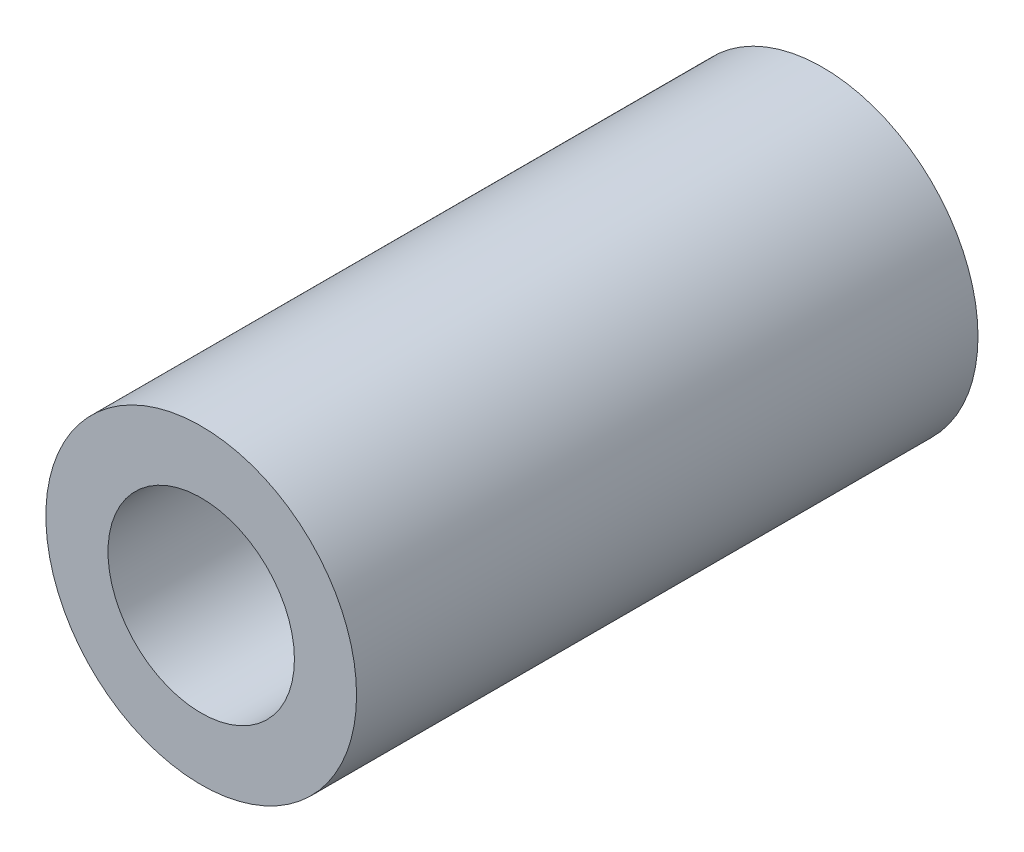
from build123d import *

# Parameters (mm, degrees)
SKETCH_1_R      = 7.5
SKETCH_1_R_2    = 4.5
EXTRUDE_1_DEPTH = 15


with BuildPart() as part:
    # 草图1 → 凸台-拉伸1 (new, symmetric)
    with BuildSketch(Plane.XY):
        Circle(SKETCH_1_R)
        Circle(SKETCH_1_R_2, mode=Mode.SUBTRACT)
    extrude(amount=EXTRUDE_1_DEPTH, both=True)


solid = part.part
